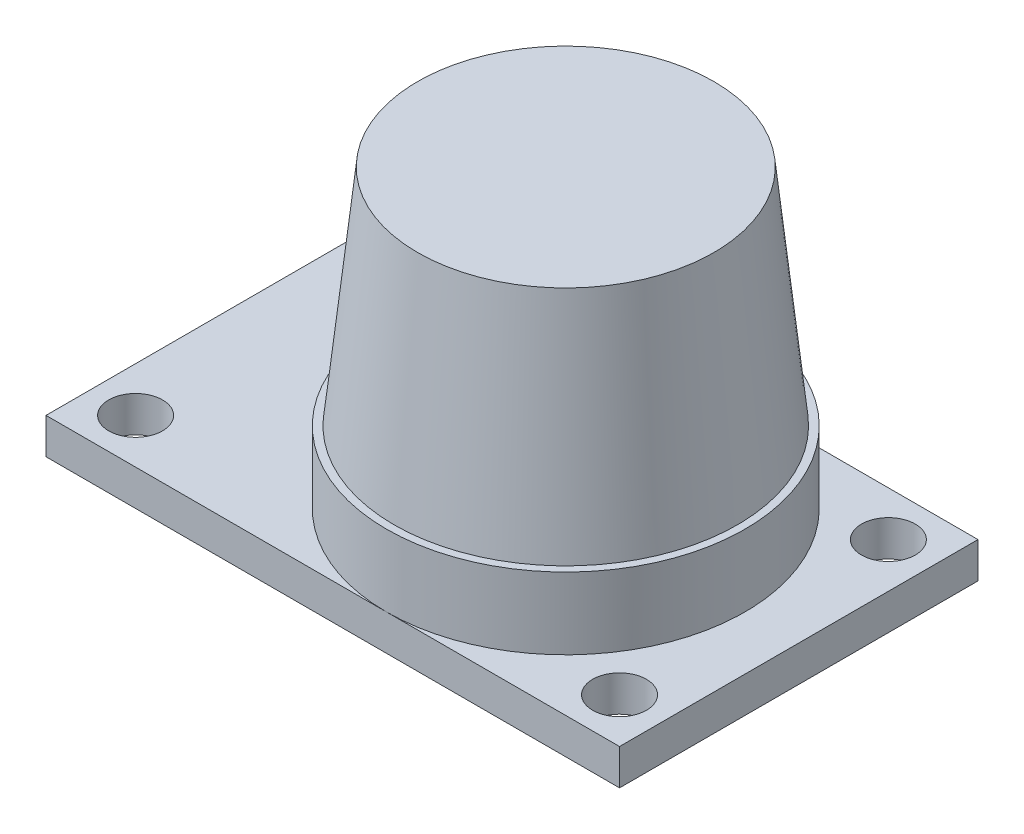
from build123d import *

# Parameters (mm, degrees)
CROQUIS1_W              = 32
CROQUIS1_H              = 20
CROQUIS1_R              = 1.5
SALIENTE_EXTRUIR1_DEPTH = 2
CROQUIS2_R              = 10
SALIENTE_EXTRUIR2_DEPTH = 16.5
SALIENTE_EXTRUIR2_TAPER = 6
CROQUIS4_R              = 10
SALIENTE_EXTRUIR3_DEPTH = 4


with BuildPart() as part:
    # Croquis1 → Saliente-Extruir1 (new body)
    with BuildSketch(Plane(origin=(0, 0, 0), x_dir=(1, 0, 0), z_dir=(0, 1, 0))):
        Rectangle(CROQUIS1_W, CROQUIS1_H)
        with Locations(Location((-13.5, 7.5, 0), (0, 0, 270))):
            Circle(CROQUIS1_R, mode=Mode.SUBTRACT)
        with Locations(Location((13.5, 7.5, 0), (0, 0, 270))):
            Circle(CROQUIS1_R, mode=Mode.SUBTRACT)
        with Locations(Location((-13.5, -7.5, 0), (0, 0, 270))):
            Circle(CROQUIS1_R, mode=Mode.SUBTRACT)
        with Locations(Location((13.5, -7.5, 0), (0, 0, 270))):
            Circle(CROQUIS1_R, mode=Mode.SUBTRACT)
    extrude(amount=SALIENTE_EXTRUIR1_DEPTH)

    # Croquis2 → Saliente-Extruir2 (add)
    with BuildSketch(Plane(origin=(0, 2, 0), x_dir=(1, 0, 0), z_dir=(0, 1, 0))):
        with Locations((3, 0)):
            Circle(CROQUIS2_R)
    extrude(amount=SALIENTE_EXTRUIR2_DEPTH, taper=SALIENTE_EXTRUIR2_TAPER)

    # Croquis4 → Saliente-Extruir3 (add)
    with BuildSketch(Plane(origin=(0, 2, 0), x_dir=(1, 0, 0), z_dir=(0, 1, 0))):
        with Locations(Location((3, 0, 0), (0, 0, 270))):
            Circle(CROQUIS4_R)
    extrude(amount=SALIENTE_EXTRUIR3_DEPTH)


solid = part.part
